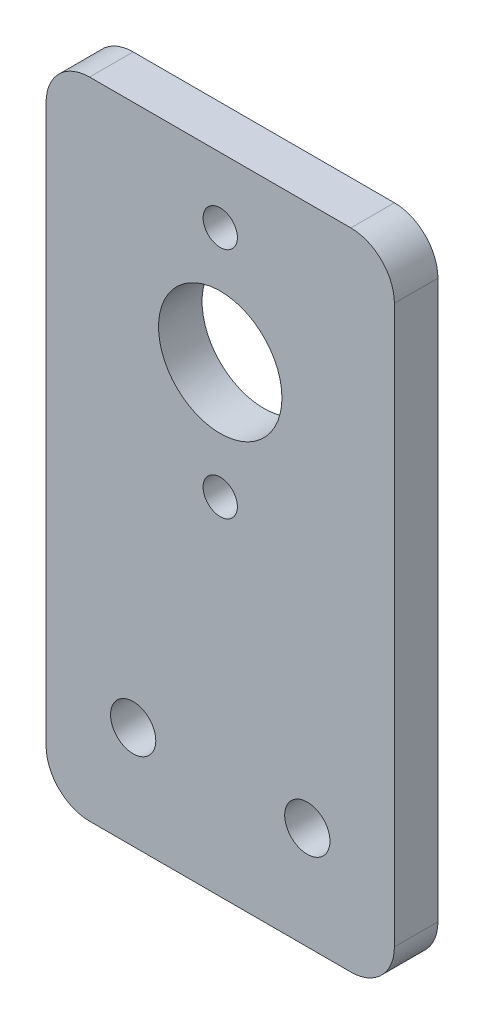
from build123d import *

# Parameters (mm, degrees)
SKETCH1_W             = 25.4
SKETCH1_H             = 47
BOSS_EXTRUDE1_DEPTH   = 3.175
SKETCH2_R             = 4.5
CUT_EXTRUDE1_DEPTH    = 27.90019749
M3X0_5_TAPPED_HOLE1_D = 2.5
FILLET1_R             = 3.175
M4X0_7_TAPPED_HOLE1_D = 3.3


with BuildPart() as part:
    # Sketch1 → Boss-Extrude1 (new body)
    with BuildSketch(Plane.XY):
        Rectangle(SKETCH1_W, SKETCH1_H)
    extrude(amount=BOSS_EXTRUDE1_DEPTH)

    # Sketch2 → Cut-Extrude1 (cut, through all)
    with BuildSketch(Plane.XY.offset(3.175)):
        with Locations((0, 10.25)):
            Circle(SKETCH2_R)
    extrude(amount=-CUT_EXTRUDE1_DEPTH, mode=Mode.SUBTRACT)

    # M3x0.5 Tapped Hole1 (through all)
    with Locations(Plane.XY.offset(3.175)):
        with Locations((0, 18.75), (0, 1.75)):
            Hole(M3X0_5_TAPPED_HOLE1_D / 2)

    # Fillet1
    fillet1_edges = [part.edges().sort_by_distance(p)[0] for p in [
        (12.7, -23.5, 1.5875),
        (-12.7, -23.5, 1.5875),
        (-12.7, 23.5, 1.5875),
        (12.7, 23.5, 1.5875),
    ]]
    fillet(fillet1_edges, radius=FILLET1_R)

    # M4x0.7 Tapped Hole1 (through all)
    with Locations(Plane.XY.offset(3.175)):
        with Locations((-6.35, -16), (6.35, -16)):
            Hole(M4X0_7_TAPPED_HOLE1_D / 2)


solid = part.part
